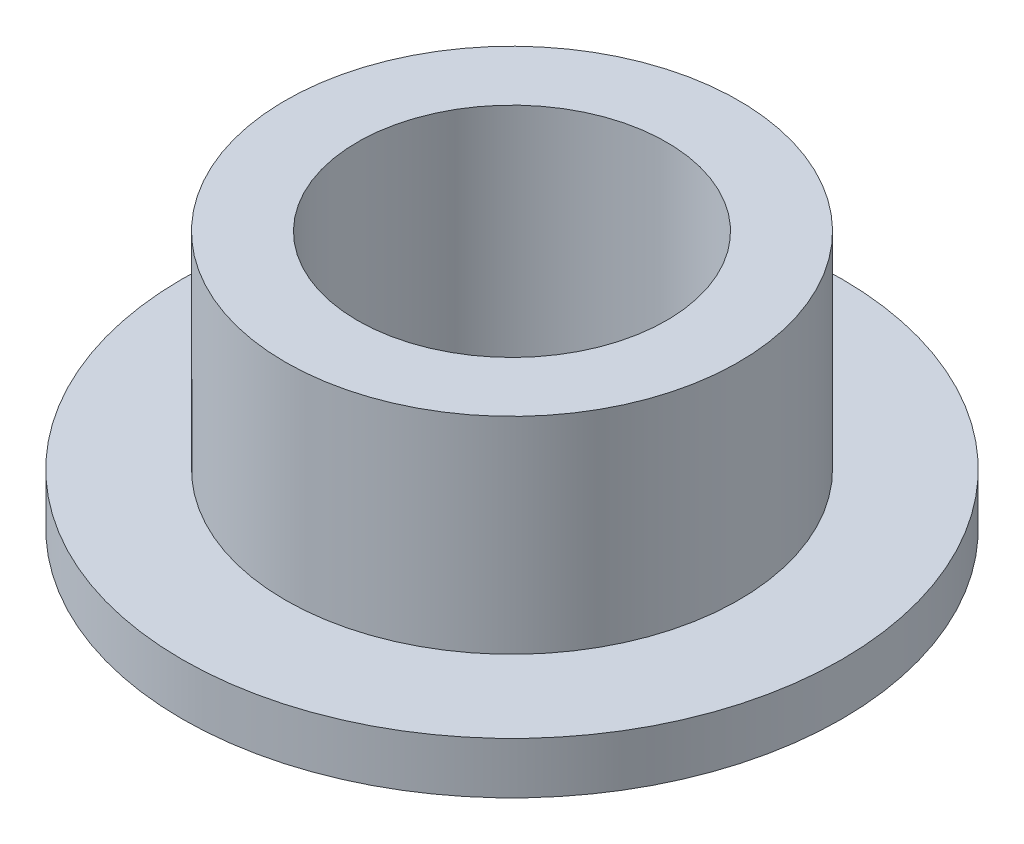
from build123d import *

# Parameters (mm, degrees)
SKETCH_1_R      = 16
SKETCH_1_R_2    = 7.5
EXTRUDE_1_DEPTH = 2.5
SKETCH_2_R      = 11
SKETCH_2_R_2    = 7.5
EXTRUDE_2_DEPTH = 10


with BuildPart() as part:
    # 草圖1 → 填料-伸長1 (new body)
    with BuildSketch(Plane(origin=(0, 0, 0), x_dir=(1, 0, 0), z_dir=(0, 1, 0))):
        with Locations(Location((0, 0, 0), (0, 0, 270))):
            Circle(SKETCH_1_R)
        with Locations(Location((0, 0, 0), (0, 0, 270))):
            Circle(SKETCH_1_R_2, mode=Mode.SUBTRACT)
    extrude(amount=EXTRUDE_1_DEPTH)

    # 草圖2 → 填料-伸長2 (add)
    with BuildSketch(Plane(origin=(0, 2.5, 0), x_dir=(1, 0, 0), z_dir=(0, 1, 0))):
        with Locations(Location((0, 0, 0), (0, 0, 270))):
            Circle(SKETCH_2_R)
        with Locations(Location((0, 0, 0), (0, 0, 270))):
            Circle(SKETCH_2_R_2, mode=Mode.SUBTRACT)
    extrude(amount=EXTRUDE_2_DEPTH)


solid = part.part
